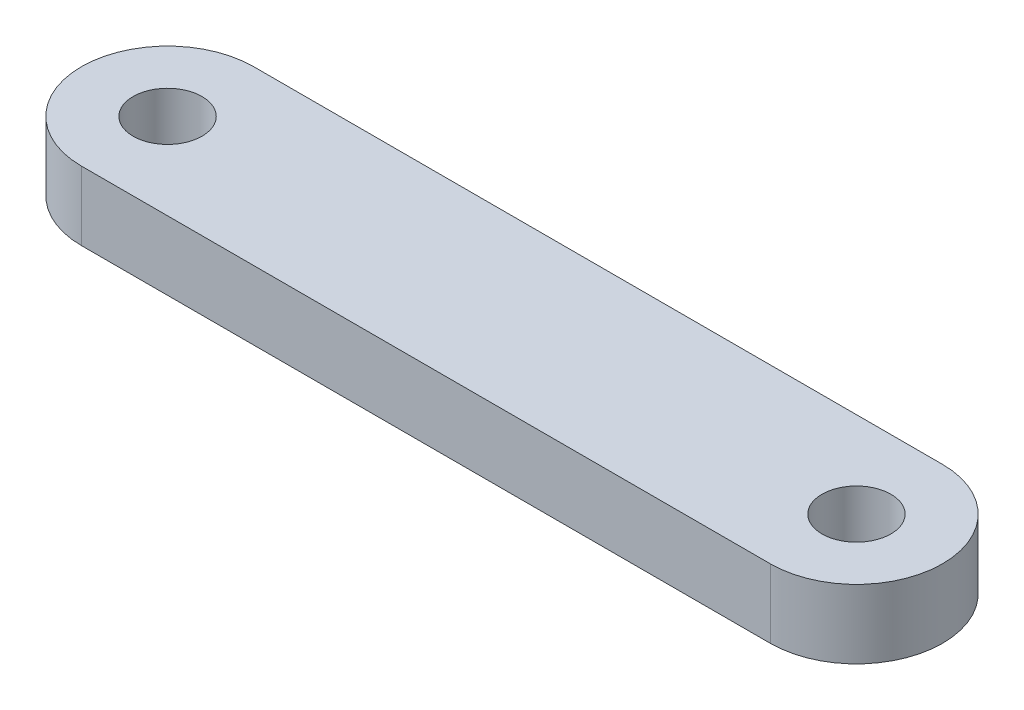
from build123d import *

# Parameters (mm, degrees)
SKETCH1_R           = 1
BOSS_EXTRUDE1_DEPTH = 2


with BuildPart() as part:
    # Sketch1 → Boss-Extrude1 (new body)
    with BuildSketch(Plane(origin=(0, 0, 0), x_dir=(1, 0, 0), z_dir=(0, 1, 0))):
        with BuildLine():
            Line((0, 2.5), (20, 2.5))
            ThreePointArc((20, 2.5), (22.5, 0), (20, -2.5))
            Line((20, -2.5), (0, -2.5))
            ThreePointArc((0, -2.5), (-2.5, 0), (0, 2.5))
        make_face()
        with Locations(Location((0, 0, 0), (0, 0, 270))):
            Circle(SKETCH1_R, mode=Mode.SUBTRACT)
        with Locations(Location((20, 0, 0), (0, 0, 270))):
            Circle(SKETCH1_R, mode=Mode.SUBTRACT)
    extrude(amount=BOSS_EXTRUDE1_DEPTH)


solid = part.part
